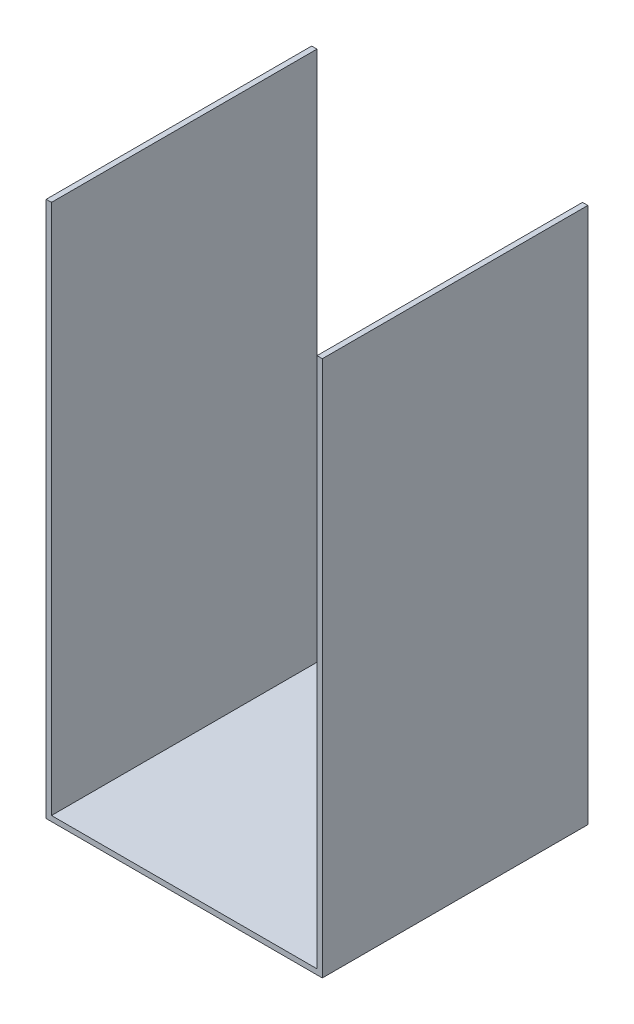
from build123d import *

# Parameters (mm, degrees)
BOSS_EXTRUDE1_DEPTH = 10000


with BuildPart() as part:
    # Sketch2 → Boss-Extrude1 (new body)
    with BuildSketch(Plane.XY):
        Polygon((0, 0), (0, -20000), (10000, -20000), (10000, 0), (10200, 0), (10200, -20200), (-200, -20200), (-200, 0), align=None)
    extrude(amount=-BOSS_EXTRUDE1_DEPTH)


solid = part.part
